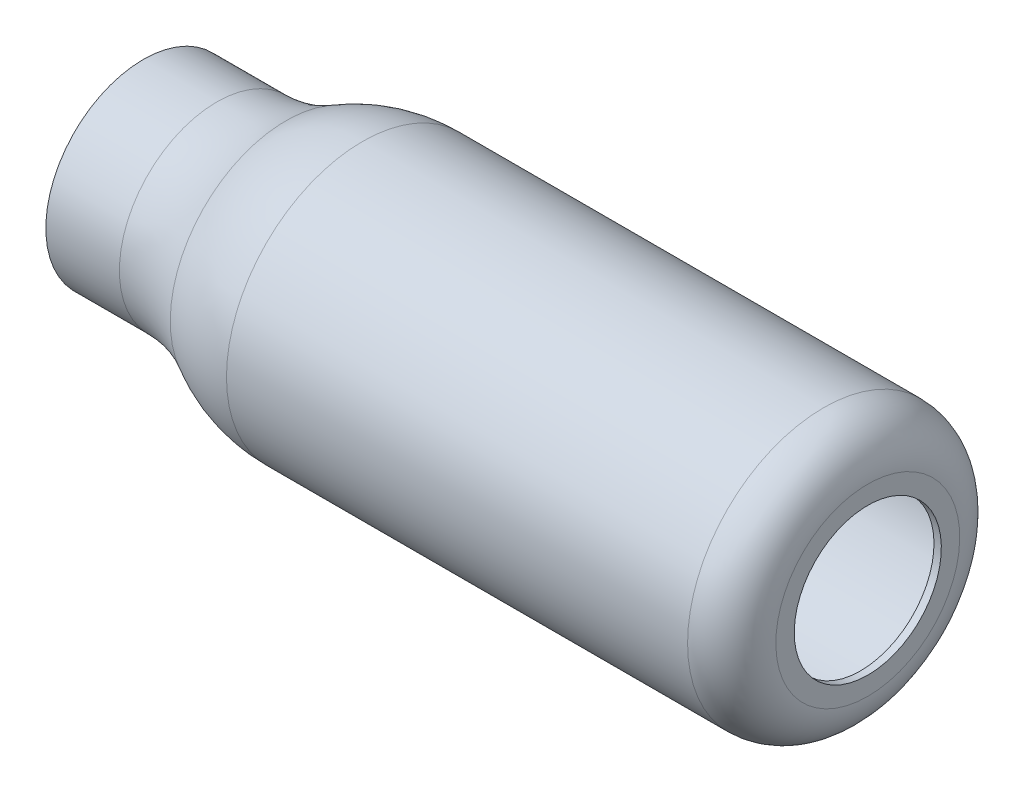
from build123d import *


with BuildPart() as part:
    # Exhaust Cover Sketch → Exhaust Cover (revolve)
    with BuildSketch(Plane.XY, mode=Mode.PRIVATE) as exhaust_cover_sk:
        with BuildLine():
            Line((0, 15.5575), (12.7, 15.5575))
            ThreePointArc((12.7, 15.5575), (19.206813736, 16.40507904), (25.279372438, 18.89125))
            ThreePointArc((25.279372438, 18.89125), (31.35193114, 21.37742096), (37.858744876, 22.225))
            Line((37.858744876, 22.225), (117.475, 22.225))
            ThreePointArc((117.475, 22.225), (121.965128061, 20.365128061), (123.825, 15.875))
            Line((123.825, 15.875), (123.825, 12.7))
            Line((123.825, 12.7), (125.095, 12.7))
            Line((125.095, 12.7), (125.095, 15.875))
            ThreePointArc((125.095, 15.875), (122.863153673, 21.263153673), (117.475, 23.495))
            Line((117.475, 23.495), (37.858744876, 23.495))
            ThreePointArc((37.858744876, 23.495), (31.026590453, 22.605042008), (24.650403816, 19.9945625))
            ThreePointArc((24.650403816, 19.9945625), (18.88147305, 17.632700088), (12.7, 16.8275))
            Line((12.7, 16.8275), (0, 16.8275))
            Line((0, 16.8275), (0, 15.5575))
        make_face()
    revolve(exhaust_cover_sk.sketch.rotate(Axis((0, 0, 0), (1, 0, 0)), 180), axis=Axis((0, 0, 0), (1, 0, 0)))


solid = part.part
